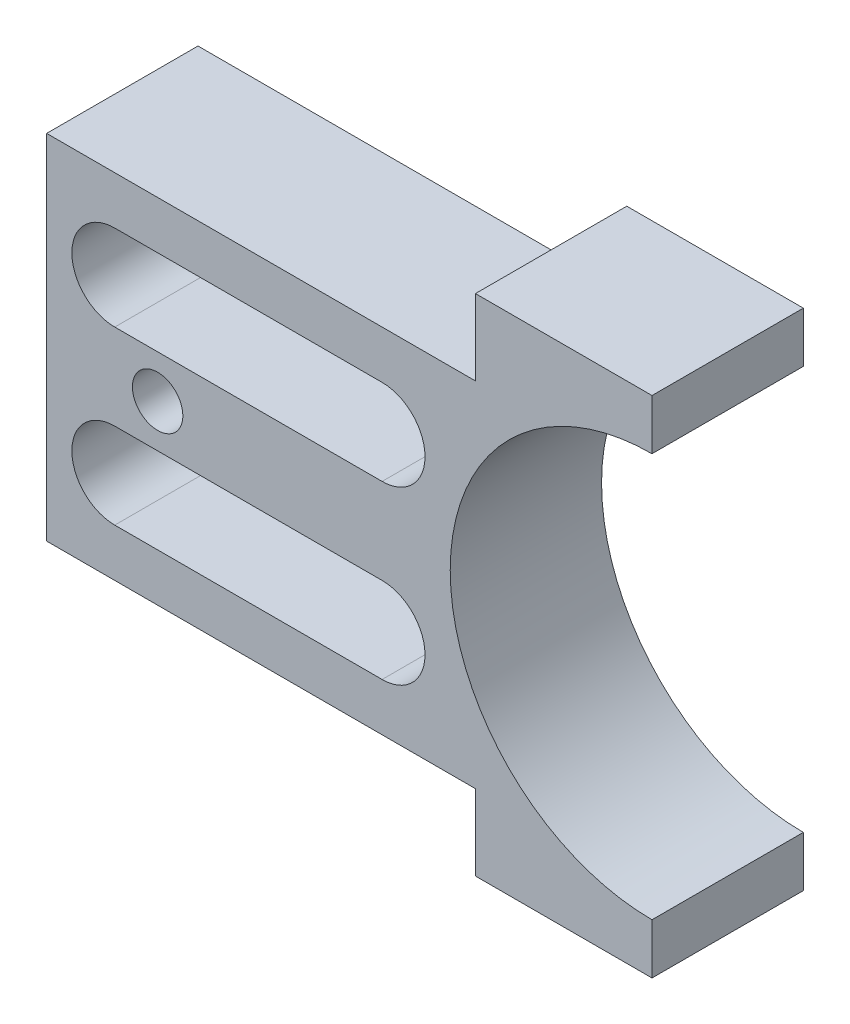
from build123d import *

# Parameters (mm, degrees)
EXTRUDE_1_DEPTH     = 30
CUT_EXTRUDE_1_DEPTH = 84.666002653
SKETCH_4_R          = 5
CUT_EXTRUDE_2_DEPTH = 84.666002653


with BuildPart() as part:
    # Эскиз1 → Бобышка-Вытянуть1 (new body)
    with BuildSketch(Plane.XY):
        with BuildLine():
            Line((60, -50), (60, -40))
            ThreePointArc((60, -40), (50, -38.729833462), (40.635083269, -35))
            Line((40.635083269, -35), (25, -35))
            Line((25, -35), (25, -50))
            Line((25, -50), (60, -50))
        make_face()
        with BuildLine():
            Line((25, -35), (40.635083269, -35))
            ThreePointArc((40.635083269, -35), (31.715728753, -28.284271247), (25, -19.364916731))
            Line((25, -19.364916731), (25, -35))
        make_face()
        with BuildLine():
            Line((25, 19.364916731), (25, 35))
            Line((25, 35), (-60, 35))
            Line((-60, 35), (-60, -35))
            Line((-60, -35), (25, -35))
            Line((25, -35), (25, -19.364916731))
            ThreePointArc((25, -19.364916731), (20, 0), (25, 19.364916731))
        make_face()
        with BuildLine():
            ThreePointArc((25, 19.364916731), (31.715728753, 28.284271247), (40.635083269, 35))
            Line((40.635083269, 35), (25, 35))
            Line((25, 35), (25, 19.364916731))
        make_face()
        with BuildLine():
            ThreePointArc((40.635083269, 35), (50, 38.729833462), (60, 40))
            Line((60, 40), (60, 50))
            Line((60, 50), (25, 50))
            Line((25, 50), (25, 35))
            Line((25, 35), (40.635083269, 35))
        make_face()
    extrude(amount=EXTRUDE_1_DEPTH)

    # Эскиз3 → Вырез-Вытянуть1 (cut, through all)
    with BuildSketch(Plane.XY.offset(30)):
        with BuildLine():
            Line((-46.5, 25.5), (6.5, 25.5))
            ThreePointArc((6.5, 25.5), (15, 17), (6.5, 8.5))
            Line((6.5, 8.5), (-46.5, 8.5))
            ThreePointArc((-46.5, 8.5), (-55, 17), (-46.5, 25.5))
        make_face()
        with BuildLine():
            Line((-46.5, -25.5), (6.5, -25.5))
            ThreePointArc((6.5, -25.5), (15, -17), (6.5, -8.5))
            Line((6.5, -8.5), (-46.5, -8.5))
            ThreePointArc((-46.5, -8.5), (-55, -17), (-46.5, -25.5))
        make_face()
    extrude(amount=-CUT_EXTRUDE_1_DEPTH, mode=Mode.SUBTRACT)

    # Эскиз4 → Вырез-Вытянуть2 (cut, through all)
    with BuildSketch(Plane.XY.offset(30)):
        with Locations((-38, 0)):
            Circle(SKETCH_4_R)
    extrude(amount=-CUT_EXTRUDE_2_DEPTH, mode=Mode.SUBTRACT)


solid = part.part
